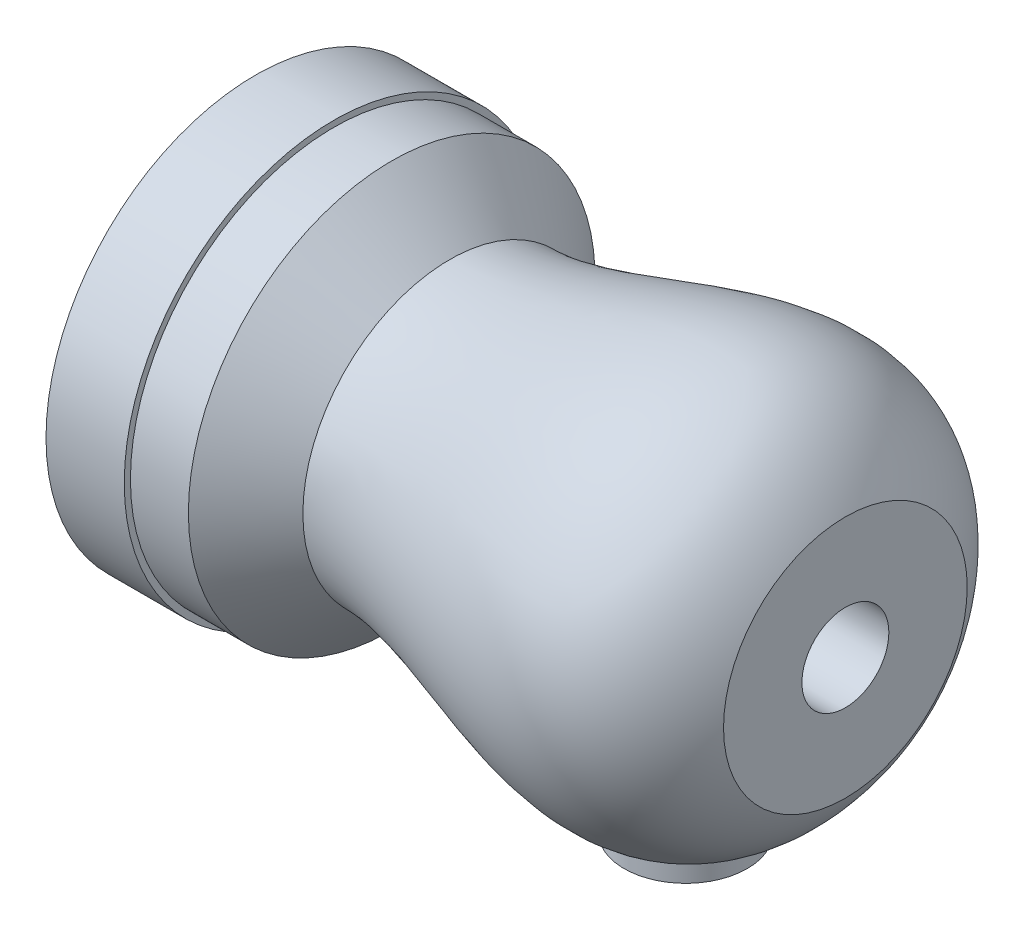
from build123d import *

# Parameters (mm, degrees)
EXTRUDE_1_DEPTH      = 33
EXTRUDE_1_DEPTH_BACK = 10
SKETCH_3_R           = 21.25
SKETCH_3_R_2         = 11.25
SKETCH_4_R           = 72.26496
EXTRUDE_1_2_DEPTH    = 27
SKETCH_2_R           = 15
CUT_EXTRUDE_1_DEPTH  = 220


with BuildPart() as part:
    # 草圖1 → 旋轉1 (revolve)
    with BuildSketch(Plane.XY, mode=Mode.PRIVATE) as revolve_1_sk:
        with BuildLine():
            Line((0, 0), (0, 70.143356265))
            Line((0, 70.143356265), (20, 70.143356265))
            Line((20, 70.143356265), (40, 50.650757283))
            add(Edge.make_bspline(
                [(40, 50.650757283), (85.38972146, 50.733312628), (143.705322116, 100.003369352), (176.495570272, 42.029481433)],
                knots=[0, 0, 0, 0, 1, 1, 1, 1], degree=3))
            Line((176.495570272, 42.029481433), (176.495570272, 0))
            Line((176.495570272, 0), (0, 0))
        make_face()
    revolve(revolve_1_sk.sketch.rotate(Axis((0, 0, 0), (1, 0, 0)), 90), axis=Axis((0, 0, 0), (1, 0, 0)))

    # 草圖3 → Extrude 1 (add, two sides: drawn at the far end of the back side and taken through both)
    with BuildSketch(Plane(origin=(0, -70, 0), x_dir=(1, 0, 0), z_dir=(0, 1, 0)).offset(-EXTRUDE_1_DEPTH_BACK)):
        with Locations((121.401340983, 0)):
            Circle(SKETCH_3_R)
        with Locations((121.401340983, 0)):
            Circle(SKETCH_3_R_2, mode=Mode.SUBTRACT)
    extrude(amount=EXTRUDE_1_DEPTH + EXTRUDE_1_DEPTH_BACK)

    # 草圖4 → Extrude 1 2 (add)
    with BuildSketch(Plane.ZY):
        Circle(SKETCH_4_R)
    extrude(amount=EXTRUDE_1_2_DEPTH)

    # 草圖2 → 除料-伸長1 (cut)
    with BuildSketch(Plane(origin=(176.495570272, 0, 0), x_dir=(0, 0, -1), z_dir=(1, 0, 0))):
        Circle(SKETCH_2_R)
    extrude(amount=-CUT_EXTRUDE_1_DEPTH, mode=Mode.SUBTRACT)


solid = part.part
